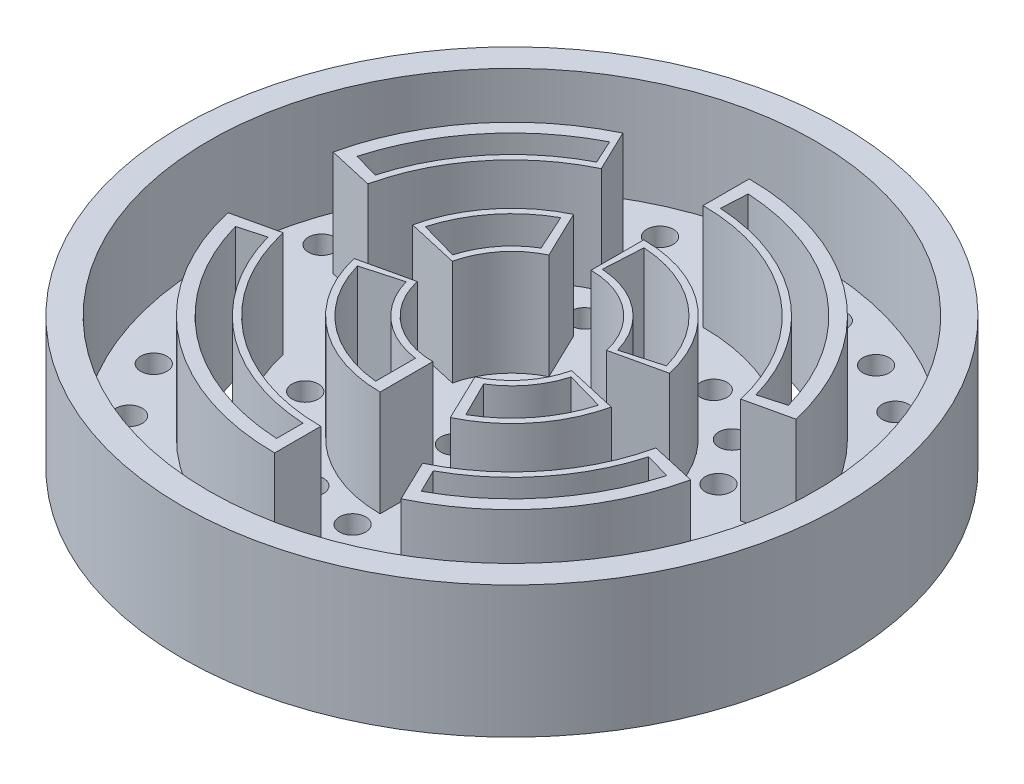
from build123d import *

# Parameters (mm, degrees)
SKETCH1_R           = 63.5
SKETCH1_R_2         = 38.1
SKETCH1_R_3         = 12.7
BOSS_EXTRUDE1_DEPTH = 25.4
SKETCH2_R           = 58.42
CUT_EXTRUDE3_DEPTH  = 20.32
CUT_EXTRUDE4_DEPTH  = 25.4
SKETCH4_R           = 2.54
CUT_EXTRUDE5_DEPTH  = 25.4


with BuildPart() as part:
    # Sketch1 → Boss-Extrude1 (new body)
    # profile 1 of 3: a face of its own
    with BuildSketch(Plane(origin=(0, 0, 0), x_dir=(1, 0, 0), z_dir=(0, 1, 0))):
        with Locations(Location((0, 0, 0), (0, 0, 270))):
            Circle(SKETCH1_R)
        Circle(SKETCH1_R_2, mode=Mode.SUBTRACT)
    # profile 2 of 3: a face of its own
    with BuildSketch(Plane(origin=(0, 0, 0), x_dir=(1, 0, 0), z_dir=(0, 1, 0))):
        Circle(SKETCH1_R_2)
        Circle(SKETCH1_R_3, mode=Mode.SUBTRACT)
    # profile 3 of 3: a face of its own
    with BuildSketch(Plane(origin=(0, 0, 0), x_dir=(1, 0, 0), z_dir=(0, 1, 0))):
        Circle(SKETCH1_R_3)
    extrude(amount=BOSS_EXTRUDE1_DEPTH)

    # Sketch2 → Cut-Extrude3 (cut)
    with BuildSketch(Plane(origin=(0, 25.4, 0), x_dir=(1, 0, 0), z_dir=(0, 1, 0))):
        with Locations(Location((0, 0, 0), (0, 0, 270))):
            Circle(SKETCH2_R)
        with BuildLine():
            Line((0, 15.24), (0, 25.4))
            ThreePointArc((0, 25.4), (15.846148637, 19.850933816), (24.768570696, 5.628312864))
            Line((24.768570696, 5.628312864), (14.861142417, 3.376987718))
            ThreePointArc((14.861142417, 3.376987718), (9.507689182, 11.91056029), (0, 15.24))
        make_face(mode=Mode.SUBTRACT)
        with BuildLine():
            Line((0, -15.24), (0, -25.4))
            ThreePointArc((0, -25.4), (-15.846148637, -19.850933816), (-24.768570696, -5.628312864))
            Line((-24.768570696, -5.628312864), (-14.861142417, -3.376987718))
            ThreePointArc((-14.861142417, -3.376987718), (-9.507689182, -11.91056029), (0, -15.24))
        make_face(mode=Mode.SUBTRACT)
        with BuildLine():
            Line((-44.583427252, 10.130963155), (-35.914427509, 8.161053652))
            ThreePointArc((-35.914427509, 8.161053652), (-28.803044899, 22.952853952), (-15.971836927, 33.186583512))
            Line((-15.971836927, 33.186583512), (-19.827107909, 41.197138152))
            ThreePointArc((-19.827107909, 41.197138152), (-35.755504013, 28.493198009), (-44.583427252, 10.130963155))
        make_face(mode=Mode.SUBTRACT)
        with BuildLine():
            Line((-44.583427252, -10.130963155), (-35.914427509, -8.161053652))
            ThreePointArc((-35.914427509, -8.161053652), (-22.976915524, -28.783854033), (0, -36.83))
            Line((0, -36.83), (0, -45.72))
            ThreePointArc((0, -45.72), (-28.523067547, -35.731680869), (-44.583427252, -10.130963155))
        make_face(mode=Mode.SUBTRACT)
        with BuildLine():
            Line((-24.768570696, 5.628312864), (-14.861142417, 3.376987718))
            ThreePointArc((-14.861142417, 3.376987718), (-11.918501338, 9.49773267), (-6.60903597, 13.732379384))
            Line((-6.60903597, 13.732379384), (-11.01505995, 22.887298974))
            ThreePointArc((-11.01505995, 22.887298974), (-19.864168896, 15.82955445), (-24.768570696, 5.628312864))
        make_face(mode=Mode.SUBTRACT)
        with BuildLine():
            Line((15.971836927, -33.186583512), (19.827107909, -41.197138152))
            ThreePointArc((19.827107909, -41.197138152), (35.755504013, -28.493198009), (44.583427252, -10.130963155))
            Line((44.583427252, -10.130963155), (35.914427509, -8.161053652))
            ThreePointArc((35.914427509, -8.161053652), (28.803044899, -22.952853952), (15.971836927, -33.186583512))
        make_face(mode=Mode.SUBTRACT)
        with BuildLine():
            Line((35.914427509, 8.161053652), (44.583427252, 10.130963155))
            ThreePointArc((44.583427252, 10.130963155), (28.523067547, 35.731680869), (0, 45.72))
            Line((0, 45.72), (0, 36.83))
            ThreePointArc((0, 36.83), (22.976915524, 28.783854033), (35.914427509, 8.161053652))
        make_face(mode=Mode.SUBTRACT)
        with BuildLine():
            Line((14.861142417, -3.376987718), (24.768570696, -5.628312864))
            ThreePointArc((24.768570696, -5.628312864), (19.864168896, -15.82955445), (11.01505995, -22.887298974))
            Line((11.01505995, -22.887298974), (6.60903597, -13.732379384))
            ThreePointArc((6.60903597, -13.732379384), (11.918501338, -9.49773267), (14.861142417, -3.376987718))
        make_face(mode=Mode.SUBTRACT)
    extrude(amount=-CUT_EXTRUDE3_DEPTH, mode=Mode.SUBTRACT)

    # Sketch3 → Cut-Extrude4 (cut)
    with BuildSketch(Plane(origin=(0, 25.4, 0), x_dir=(1, 0, 0), z_dir=(0, 1, 0))):
        with BuildLine():
            Line((-41.560477266, 11.71491056), (-36.671009352, 10.336685788))
            ThreePointArc((-36.671009352, 10.336685788), (-29.531199398, 24.073185541), (-17.515635832, 33.835077972))
            Line((-17.515635832, 33.835077972), (-19.628948908, 38.460587161))
            ThreePointArc((-19.628948908, 38.460587161), (-33.389658176, 27.379611518), (-41.560477266, 11.71491056))
        make_face()
        with BuildLine():
            Line((2.410958238, 43.11263945), (2.127316092, 38.040564221))
            ThreePointArc((2.127316092, 38.040564221), (23.837024445, 29.722151093), (36.671009352, 10.336685788))
            Line((36.671009352, 10.336685788), (41.560477266, 11.71491056))
            ThreePointArc((41.560477266, 11.71491056), (27.015294371, 33.685104572), (2.410958238, 43.11263945))
        make_face()
        with BuildLine():
            Line((-41.560477266, -11.71491056), (-36.671009352, -10.336685788))
            ThreePointArc((-36.671009352, -10.336685788), (-23.879757361, -29.68782896), (-2.236755681, -38.034286164))
            Line((-2.236755681, -38.034286164), (-2.236755681, -43.122028292))
            ThreePointArc((-2.236755681, -43.122028292), (-26.947192145, -33.739609296), (-41.560477266, -11.71491056))
        make_face()
        with BuildLine():
            Line((8.628181311, -14.076028817), (12.032475138, -20.915937513))
            ThreePointArc((12.032475138, -20.915937513), (19.036585895, -14.827855458), (23.22497259, -6.546567666))
            Line((23.22497259, -6.546567666), (15.890770719, -4.479230508))
            ThreePointArc((15.890770719, -4.479230508), (13.165082097, -9.962967097), (8.628181311, -14.076028817))
        make_face()
        with BuildLine():
            Line((-23.22497259, 6.546567666), (-15.890770719, 4.479230508))
            ThreePointArc((-15.890770719, 4.479230508), (-13.126265899, 10.014052304), (-8.518520663, 14.142662611))
            Line((-8.518520663, 14.142662611), (-11.69912487, 21.104202834))
            ThreePointArc((-11.69912487, 21.104202834), (-18.918359635, 14.978403411), (-23.22497259, 6.546567666))
        make_face()
        with BuildLine():
            Line((1.347300192, 24.09235734), (0.921836973, 16.484244496))
            ThreePointArc((0.921836973, 16.484244496), (10.329377259, 12.879598807), (15.890770719, 4.479230508))
            Line((15.890770719, 4.479230508), (23.22497259, 6.546567666))
            ThreePointArc((23.22497259, 6.546567666), (15.096782148, 18.824029026), (1.347300192, 24.09235734))
        make_face()
        with BuildLine():
            Line((36.671009352, -10.336685788), (41.560477266, -11.71491056))
            ThreePointArc((41.560477266, -11.71491056), (33.709759421, -26.984523708), (20.529249355, -37.987660114))
            Line((20.529249355, -37.987660114), (18.264285582, -33.436893877))
            ThreePointArc((18.264285582, -33.436893877), (29.797257606, -23.743071393), (36.671009352, -10.336685788))
        make_face()
        with BuildLine():
            Line((-2.236755681, -24.026107134), (-2.236755681, -16.357781757))
            ThreePointArc((-2.236755681, -16.357781757), (-10.836364625, -12.456054821), (-15.890770719, -4.479230508))
            Line((-15.890770719, -4.479230508), (-23.22497259, -6.546567666))
            ThreePointArc((-23.22497259, -6.546567666), (-15.442100785, -18.541802053), (-2.236755681, -24.026107134))
        make_face()
    extrude(amount=-CUT_EXTRUDE4_DEPTH, mode=Mode.SUBTRACT)

    # Sketch4 → Cut-Extrude5 (cut)
    with BuildSketch(Plane(origin=(0, 5.08, 0), x_dir=(1, 0, 0), z_dir=(0, 1, 0))):
        with Locations(Location((-1.724152615, 51.49281591, 0), (0, 0, 270))):
            Circle(SKETCH4_R)
        with Locations(Location((11.455505559, 50.554586805, 0), (0, 0, 270))):
            Circle(SKETCH4_R)
        with Locations(Location((22.989926713, 47.168810965, 0), (0, 0, 270))):
            Circle(SKETCH4_R)
        with Locations(Location((32.623601803, 41.254574374, 0), (0, 0, 270))):
            Circle(SKETCH4_R)
        with Locations(Location((40.612039872, 33.129886899, 0), (0, 0, 270))):
            Circle(SKETCH4_R)
        with Locations(Location((46.889773478, 22.062196609, 0), (0, 0, 270))):
            Circle(SKETCH4_R)
        with Locations(Location((0.944980786, 29.822975433, 0), (0, 0, 270))):
            Circle(SKETCH4_R)
        with Locations(Location((11.455505559, 27.425288656, 0), (0, 0, 270))):
            Circle(SKETCH4_R)
        with Locations(Location((21.49305655, 20.890650515, 0), (0, 0, 270))):
            Circle(SKETCH4_R)
        with Locations(Location((27.649396358, 12.142696745, 0), (0, 0, 270))):
            Circle(SKETCH4_R)
        with Locations(Location((4.47089158, 6.703649275, 0), (0, 0, 270))):
            Circle(SKETCH4_R)
        with Locations(Location((-6.800781702, 4.321707228, 0), (0, 0, 270))):
            Circle(SKETCH4_R)
        with Locations(Location((-30.198137813, -0.081706015, 0), (0, 0, 270))):
            Circle(SKETCH4_R)
        with Locations(Location((-28.107340926, 10.409041498, 0), (0, 0, 270))):
            Circle(SKETCH4_R)
        with Locations(Location((-21.571705433, 20.445943123, 0), (0, 0, 270))):
            Circle(SKETCH4_R)
        with Locations(Location((-12.9298253, 26.890936578, 0), (0, 0, 270))):
            Circle(SKETCH4_R)
        with Locations(Location((-51.806737387, 1.205544426, 0), (0, 0, 270))):
            Circle(SKETCH4_R)
        with Locations(Location((-50.543433135, 13.866814898, 0), (0, 0, 270))):
            Circle(SKETCH4_R)
        with Locations(Location((-46.525015628, 24.528803929, 0), (0, 0, 270))):
            Circle(SKETCH4_R)
        with Locations(Location((-40.107727488, 33.834947228, 0), (0, 0, 270))):
            Circle(SKETCH4_R)
        with Locations(Location((-30.92924558, 41.597795885, 0), (0, 0, 270))):
            Circle(SKETCH4_R)
        with Locations(Location((-19.255969941, 47.787973531, 0), (0, 0, 270))):
            Circle(SKETCH4_R)
        with Locations(Location((1.839601167, -51.488820729, 0), (0, 0, 270))):
            Circle(SKETCH4_R)
        with Locations(Location((-11.342127499, -50.58014431, 0), (0, 0, 270))):
            Circle(SKETCH4_R)
        with Locations(Location((-22.884110964, -47.220238495, 0), (0, 0, 270))):
            Circle(SKETCH4_R)
        with Locations(Location((-32.531022245, -41.32761659, 0), (0, 0, 270))):
            Circle(SKETCH4_R)
        with Locations(Location((-40.53765673, -33.220860545, 0), (0, 0, 270))):
            Circle(SKETCH4_R)
        with Locations(Location((-46.840189607, -22.167273483, 0), (0, 0, 270))):
            Circle(SKETCH4_R)
        with Locations(Location((-0.87811183, -29.825019228, 0), (0, 0, 270))):
            Circle(SKETCH4_R)
        with Locations(Location((-11.393986077, -27.450904298, 0), (0, 0, 270))):
            Circle(SKETCH4_R)
        with Locations(Location((-21.446163257, -20.938787939, 0), (0, 0, 270))):
            Circle(SKETCH4_R)
        with Locations(Location((-27.622101521, -12.204659388, 0), (0, 0, 270))):
            Circle(SKETCH4_R)
        with Locations(Location((-4.45584998, -6.713656684, 0), (0, 0, 270))):
            Circle(SKETCH4_R)
        with Locations(Location((6.810454379, -4.306448221, 0), (0, 0, 270))):
            Circle(SKETCH4_R)
        with Locations(Location((30.197878714, 0.149413549, 0), (0, 0, 270))):
            Circle(SKETCH4_R)
        with Locations(Location((28.130608559, -10.345995405, 0), (0, 0, 270))):
            Circle(SKETCH4_R)
        with Locations(Location((21.617493395, -20.397525457, 0), (0, 0, 270))):
            Circle(SKETCH4_R)
        with Locations(Location((12.990085409, -26.861878814, 0), (0, 0, 270))):
            Circle(SKETCH4_R)
        with Locations(Location((51.809310139, -1.089384662, 0), (0, 0, 270))):
            Circle(SKETCH4_R)
        with Locations(Location((50.574397104, -13.753455785, 0), (0, 0, 270))):
            Circle(SKETCH4_R)
        with Locations(Location((46.579895118, -24.424427775, 0), (0, 0, 270))):
            Circle(SKETCH4_R)
        with Locations(Location((40.183488564, -33.74493599, 0), (0, 0, 270))):
            Circle(SKETCH4_R)
        with Locations(Location((31.022434937, -41.528344359, 0), (0, 0, 270))):
            Circle(SKETCH4_R)
        with Locations(Location((19.363067737, -47.744679288, 0), (0, 0, 270))):
            Circle(SKETCH4_R)
    extrude(amount=-CUT_EXTRUDE5_DEPTH, mode=Mode.SUBTRACT)


solid = part.part
